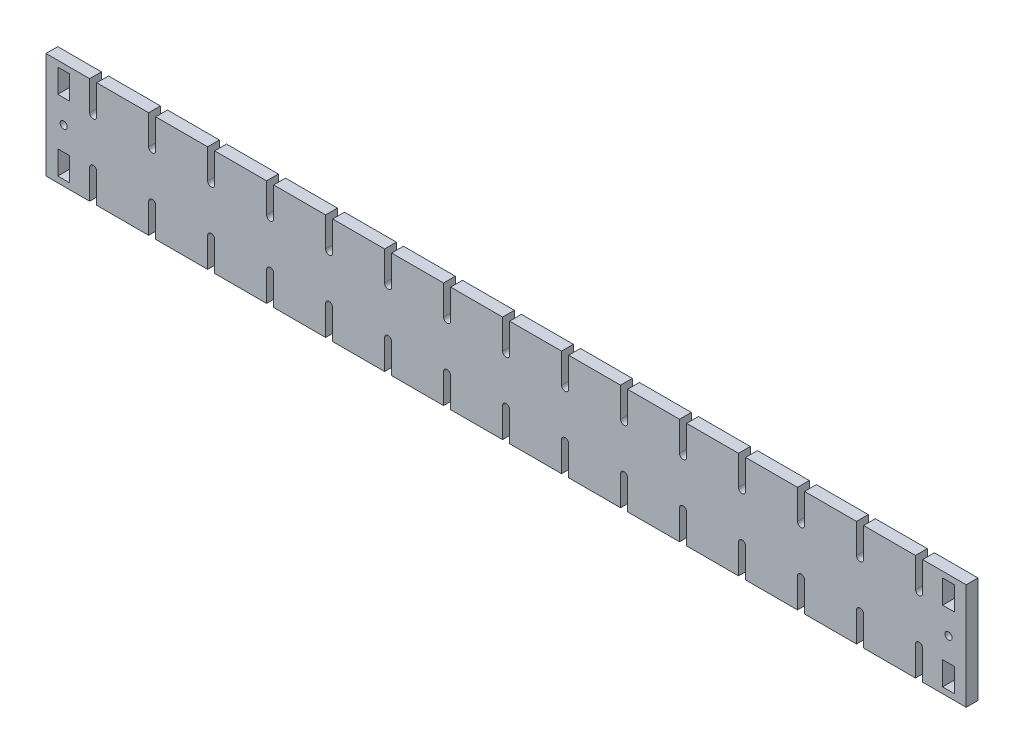
from build123d import *

# Parameters (mm, degrees)
SKETCH1_W           = 390
SKETCH1_H           = 45
SKETCH1_R           = 1.5
SKETCH1_W_2         = 5
SKETCH1_H_2         = 10
BOSS_EXTRUDE1_DEPTH = 5
CUT_EXTRUDE1_DEPTH  = 5


with BuildPart() as part:
    # Sketch1 → Boss-Extrude1 (new body)
    with BuildSketch(Plane.XY):
        with Locations((109.186746988, 0)):
            Rectangle(SKETCH1_W, SKETCH1_H)
        with Locations((-78.313253012, 0)):
            Circle(SKETCH1_R, mode=Mode.SUBTRACT)
        with Locations(Location((296.686746988, 0, 0), (0, 0, 180))):
            Circle(SKETCH1_R, mode=Mode.SUBTRACT)
        with Locations((-78.313253012, -15)):
            Rectangle(SKETCH1_W_2, SKETCH1_H_2, mode=Mode.SUBTRACT)
        with Locations((-78.313253012, 15)):
            Rectangle(SKETCH1_W_2, SKETCH1_H_2, mode=Mode.SUBTRACT)
        with Locations((296.686746988, -15)):
            Rectangle(SKETCH1_W_2, SKETCH1_H_2, mode=Mode.SUBTRACT)
        with Locations((296.686746988, 15)):
            Rectangle(SKETCH1_W_2, SKETCH1_H_2, mode=Mode.SUBTRACT)
    extrude(amount=BOSS_EXTRUDE1_DEPTH)

    # Sketch2 → Cut-Extrude1 (cut)
    with BuildSketch(Plane.XY.offset(5)):
        with BuildLine():
            Line((-67.313253012, 22.5), (-64.313253012, 22.5))
            Line((-64.313253012, 22.5), (-64.313253012, 10))
            ThreePointArc((-64.313253012, 10), (-65.813253012, 8.5), (-67.313253012, 10))
            Line((-67.313253012, 10), (-67.313253012, 22.5))
        make_face()
        with BuildLine():
            Line((-42.313253012, 22.5), (-39.313253012, 22.5))
            Line((-39.313253012, 22.5), (-39.313253012, 10))
            ThreePointArc((-39.313253012, 10), (-40.813253012, 8.5), (-42.313253012, 10))
            Line((-42.313253012, 10), (-42.313253012, 22.5))
        make_face()
        with BuildLine():
            Line((-17.313253012, 22.5), (-14.313253012, 22.5))
            Line((-14.313253012, 22.5), (-14.313253012, 10))
            ThreePointArc((-14.313253012, 10), (-15.813253012, 8.5), (-17.313253012, 10))
            Line((-17.313253012, 10), (-17.313253012, 22.5))
        make_face()
        with BuildLine():
            Line((7.686746988, 22.5), (10.686746988, 22.5))
            Line((10.686746988, 22.5), (10.686746988, 10))
            ThreePointArc((10.686746988, 10), (9.186746988, 8.5), (7.686746988, 10))
            Line((7.686746988, 10), (7.686746988, 22.5))
        make_face()
        with BuildLine():
            Line((32.686746988, 22.5), (35.686746988, 22.5))
            Line((35.686746988, 22.5), (35.686746988, 10))
            ThreePointArc((35.686746988, 10), (34.186746988, 8.5), (32.686746988, 10))
            Line((32.686746988, 10), (32.686746988, 22.5))
        make_face()
        with BuildLine():
            Line((57.686746988, 22.5), (60.686746988, 22.5))
            Line((60.686746988, 22.5), (60.686746988, 10))
            ThreePointArc((60.686746988, 10), (59.186746988, 8.5), (57.686746988, 10))
            Line((57.686746988, 10), (57.686746988, 22.5))
        make_face()
        with BuildLine():
            Line((82.686746988, 22.5), (85.686746988, 22.5))
            Line((85.686746988, 22.5), (85.686746988, 10))
            ThreePointArc((85.686746988, 10), (84.186746988, 8.5), (82.686746988, 10))
            Line((82.686746988, 10), (82.686746988, 22.5))
        make_face()
        with BuildLine():
            Line((107.686746988, 22.5), (110.686746988, 22.5))
            Line((110.686746988, 22.5), (110.686746988, 10))
            ThreePointArc((110.686746988, 10), (109.186746988, 8.5), (107.686746988, 10))
            Line((107.686746988, 10), (107.686746988, 22.5))
        make_face()
        with BuildLine():
            Line((132.686746988, 22.5), (135.686746988, 22.5))
            Line((135.686746988, 22.5), (135.686746988, 10))
            ThreePointArc((135.686746988, 10), (134.186746988, 8.5), (132.686746988, 10))
            Line((132.686746988, 10), (132.686746988, 22.5))
        make_face()
        with BuildLine():
            Line((157.686746988, 22.5), (160.686746988, 22.5))
            Line((160.686746988, 22.5), (160.686746988, 10))
            ThreePointArc((160.686746988, 10), (159.186746988, 8.5), (157.686746988, 10))
            Line((157.686746988, 10), (157.686746988, 22.5))
        make_face()
        with BuildLine():
            Line((182.686746988, 22.5), (185.686746988, 22.5))
            Line((185.686746988, 22.5), (185.686746988, 10))
            ThreePointArc((185.686746988, 10), (184.186746988, 8.5), (182.686746988, 10))
            Line((182.686746988, 10), (182.686746988, 22.5))
        make_face()
        with BuildLine():
            Line((207.686746988, 22.5), (210.686746988, 22.5))
            Line((210.686746988, 22.5), (210.686746988, 10))
            ThreePointArc((210.686746988, 10), (209.186746988, 8.5), (207.686746988, 10))
            Line((207.686746988, 10), (207.686746988, 22.5))
        make_face()
        with BuildLine():
            Line((232.686746988, 22.5), (235.686746988, 22.5))
            Line((235.686746988, 22.5), (235.686746988, 10))
            ThreePointArc((235.686746988, 10), (234.186746988, 8.5), (232.686746988, 10))
            Line((232.686746988, 10), (232.686746988, 22.5))
        make_face()
        with BuildLine():
            Line((257.686746988, 22.5), (260.686746988, 22.5))
            Line((260.686746988, 22.5), (260.686746988, 10))
            ThreePointArc((260.686746988, 10), (259.186746988, 8.5), (257.686746988, 10))
            Line((257.686746988, 10), (257.686746988, 22.5))
        make_face()
        with BuildLine():
            Line((282.686746988, 22.5), (285.686746988, 22.5))
            Line((285.686746988, 22.5), (285.686746988, 10))
            ThreePointArc((285.686746988, 10), (284.186746988, 8.5), (282.686746988, 10))
            Line((282.686746988, 10), (282.686746988, 22.5))
        make_face()
        with BuildLine():
            Line((285.686746988, -22.5), (285.686746988, -10))
            ThreePointArc((285.686746988, -10), (284.186746988, -8.5), (282.686746988, -10))
            Line((282.686746988, -10), (282.686746988, -22.5))
            Line((282.686746988, -22.5), (285.686746988, -22.5))
        make_face()
        with BuildLine():
            Line((260.686746988, -22.5), (260.686746988, -10))
            ThreePointArc((260.686746988, -10), (259.186746988, -8.5), (257.686746988, -10))
            Line((257.686746988, -10), (257.686746988, -22.5))
            Line((257.686746988, -22.5), (260.686746988, -22.5))
        make_face()
        with BuildLine():
            Line((235.686746988, -22.5), (235.686746988, -10))
            ThreePointArc((235.686746988, -10), (234.186746988, -8.5), (232.686746988, -10))
            Line((232.686746988, -10), (232.686746988, -22.5))
            Line((232.686746988, -22.5), (235.686746988, -22.5))
        make_face()
        with BuildLine():
            Line((210.686746988, -22.5), (210.686746988, -10))
            ThreePointArc((210.686746988, -10), (209.186746988, -8.5), (207.686746988, -10))
            Line((207.686746988, -10), (207.686746988, -22.5))
            Line((207.686746988, -22.5), (210.686746988, -22.5))
        make_face()
        with BuildLine():
            Line((185.686746988, -22.5), (185.686746988, -10))
            ThreePointArc((185.686746988, -10), (184.186746988, -8.5), (182.686746988, -10))
            Line((182.686746988, -10), (182.686746988, -22.5))
            Line((182.686746988, -22.5), (185.686746988, -22.5))
        make_face()
        with BuildLine():
            Line((160.686746988, -22.5), (160.686746988, -10))
            ThreePointArc((160.686746988, -10), (159.186746988, -8.5), (157.686746988, -10))
            Line((157.686746988, -10), (157.686746988, -22.5))
            Line((157.686746988, -22.5), (160.686746988, -22.5))
        make_face()
        with BuildLine():
            Line((135.686746988, -22.5), (135.686746988, -10))
            ThreePointArc((135.686746988, -10), (134.186746988, -8.5), (132.686746988, -10))
            Line((132.686746988, -10), (132.686746988, -22.5))
            Line((132.686746988, -22.5), (135.686746988, -22.5))
        make_face()
        with BuildLine():
            Line((110.686746988, -22.5), (110.686746988, -10))
            ThreePointArc((110.686746988, -10), (109.186746988, -8.5), (107.686746988, -10))
            Line((107.686746988, -10), (107.686746988, -22.5))
            Line((107.686746988, -22.5), (110.686746988, -22.5))
        make_face()
        with BuildLine():
            Line((85.686746988, -22.5), (85.686746988, -10))
            ThreePointArc((85.686746988, -10), (84.186746988, -8.5), (82.686746988, -10))
            Line((82.686746988, -10), (82.686746988, -22.5))
            Line((82.686746988, -22.5), (85.686746988, -22.5))
        make_face()
        with BuildLine():
            Line((60.686746988, -22.5), (60.686746988, -10))
            ThreePointArc((60.686746988, -10), (59.186746988, -8.5), (57.686746988, -10))
            Line((57.686746988, -10), (57.686746988, -22.5))
            Line((57.686746988, -22.5), (60.686746988, -22.5))
        make_face()
        with BuildLine():
            Line((35.686746988, -22.5), (35.686746988, -10))
            ThreePointArc((35.686746988, -10), (34.186746988, -8.5), (32.686746988, -10))
            Line((32.686746988, -10), (32.686746988, -22.5))
            Line((32.686746988, -22.5), (35.686746988, -22.5))
        make_face()
        with BuildLine():
            Line((10.686746988, -22.5), (10.686746988, -10))
            ThreePointArc((10.686746988, -10), (9.186746988, -8.5), (7.686746988, -10))
            Line((7.686746988, -10), (7.686746988, -22.5))
            Line((7.686746988, -22.5), (10.686746988, -22.5))
        make_face()
        with BuildLine():
            Line((-14.313253012, -22.5), (-14.313253012, -10))
            ThreePointArc((-14.313253012, -10), (-15.813253012, -8.5), (-17.313253012, -10))
            Line((-17.313253012, -10), (-17.313253012, -22.5))
            Line((-17.313253012, -22.5), (-14.313253012, -22.5))
        make_face()
        with BuildLine():
            Line((-39.313253012, -22.5), (-39.313253012, -10))
            ThreePointArc((-39.313253012, -10), (-40.813253012, -8.5), (-42.313253012, -10))
            Line((-42.313253012, -10), (-42.313253012, -22.5))
            Line((-42.313253012, -22.5), (-39.313253012, -22.5))
        make_face()
        with BuildLine():
            Line((-64.313253012, -22.5), (-64.313253012, -10))
            ThreePointArc((-64.313253012, -10), (-65.813253012, -8.5), (-67.313253012, -10))
            Line((-67.313253012, -10), (-67.313253012, -22.5))
            Line((-67.313253012, -22.5), (-64.313253012, -22.5))
        make_face()
    extrude(amount=-CUT_EXTRUDE1_DEPTH, mode=Mode.SUBTRACT)


solid = part.part
